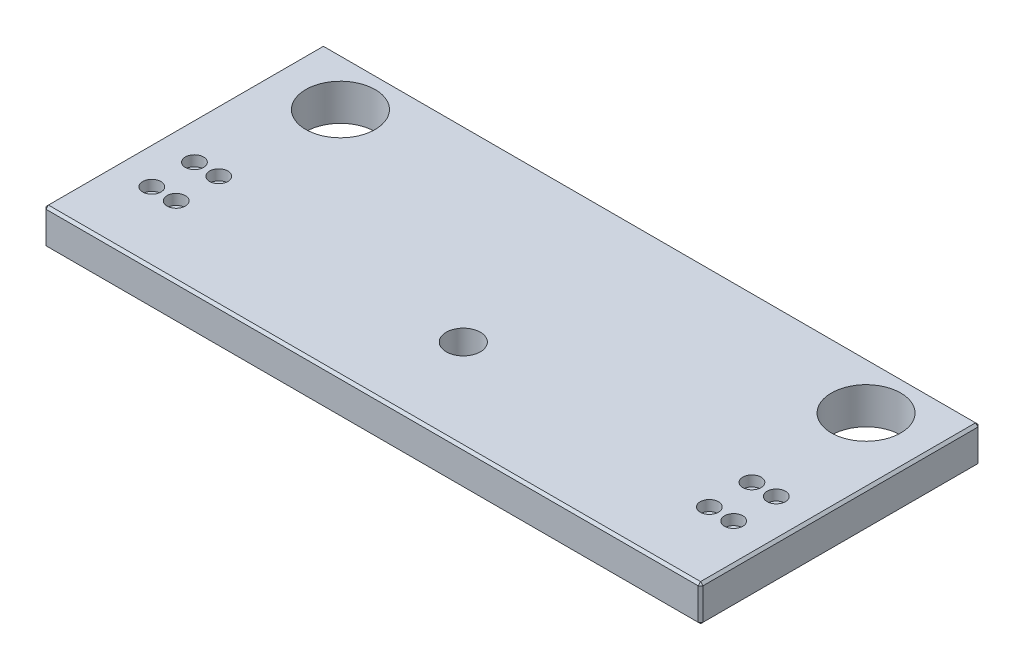
from build123d import *

# Parameters (mm, degrees)
SKETCH2_W                                           = 540
SKETCH2_H                                           = 150
BOSS_EXTRUDE1_DEPTH                                 = 30
SKETCH3_W                                           = 540
SKETCH3_H                                           = 30
BOSS_EXTRUDE2_DEPTH                                 = 80
SKETCH6_R                                           = 28.5
CUT_EXTRUDE1_DEPTH                                  = 313.769883461
CHAMFER1_SIZE                                       = 2
M30X2_0_TAPPED_HOLE1_D                              = 28
CBORE_FOR_M8_HEX_SOCKET_HEAD_CAP_SCREW1_D           = 8.4
CBORE_FOR_M8_HEX_SOCKET_HEAD_CAP_SCREW1_CBORE_D     = 15
CBORE_FOR_M8_HEX_SOCKET_HEAD_CAP_SCREW1_CBORE_DEPTH = 8.6


with BuildPart() as part:
    # Sketch2 → Boss-Extrude1 (new body)
    with BuildSketch(Plane(origin=(0, 0, 0), x_dir=(1, 0, 0), z_dir=(0, 1, 0))):
        Rectangle(SKETCH2_W, SKETCH2_H)
    extrude(amount=BOSS_EXTRUDE1_DEPTH)

    # Sketch3 → Boss-Extrude2 (add)
    with BuildSketch(Plane(origin=(0, 0, -75), x_dir=(-1, 0, 0), z_dir=(0, 0, -1))):
        with Locations((0, 15)):
            Rectangle(SKETCH3_W, SKETCH3_H)
    extrude(amount=BOSS_EXTRUDE2_DEPTH)

    # Sketch6 → Cut-Extrude1 (cut, through all)
    with BuildSketch(Plane(origin=(0, 0, 0), x_dir=(-1, 0, 0), z_dir=(0, -1, 0))):
        with Locations(Location((-216, 115, 0), (0, 0, 90))):
            Circle(SKETCH6_R)
    cut_extrude1 = extrude(amount=-CUT_EXTRUDE1_DEPTH, mode=Mode.SUBTRACT)

    # Mirror1: Cut-Extrude1 across plane
    add(cut_extrude1.mirror(Plane(origin=(0, 0, 0), x_dir=(0, 0, 1), z_dir=(1, 0, 0))), mode=Mode.SUBTRACT)

    # Chamfer1
    chamfer1_edges = [part.edges().sort_by_distance(p)[0] for p in [
        (-270, 30, -40),
        (0, 30, -155),
        (270, 15, -155),
        (0, 0, -155),
        (0, 30, 75),
        (-270, 15, -155),
        (270, 30, -40),
        (0, 0, 75),
        (-270, 0, -40),
        (270, 0, -40),
        (270, 15, 75),
        (-270, 15, 75),
    ]]
    chamfer(chamfer1_edges, length=CHAMFER1_SIZE)

    # M30x2.0 Tapped Hole1 (through all)
    with Locations(Plane(origin=(0, 30, 0), x_dir=(1, 0, 0), z_dir=(0, 1, 0))):
        with Locations((0, 0)):
            Hole(M30X2_0_TAPPED_HOLE1_D / 2)

    # CBORE for M8 Hex Socket Head Cap Screw1 (through all)
    with Locations(Plane(origin=(0, 30, 0), x_dir=(1, 0, 0), z_dir=(0, 1, 0))):
        with Locations((-238.5, 17.5), (-218.5, 17.5), (-238.5, -17.5), (-218.5, -17.5), (218.5, 18.7), (238.5, 18.7), (218.5, -16.3), (238.5, -16.3)):
            CounterBoreHole(CBORE_FOR_M8_HEX_SOCKET_HEAD_CAP_SCREW1_D / 2, CBORE_FOR_M8_HEX_SOCKET_HEAD_CAP_SCREW1_CBORE_D / 2, CBORE_FOR_M8_HEX_SOCKET_HEAD_CAP_SCREW1_CBORE_DEPTH)


solid = part.part
